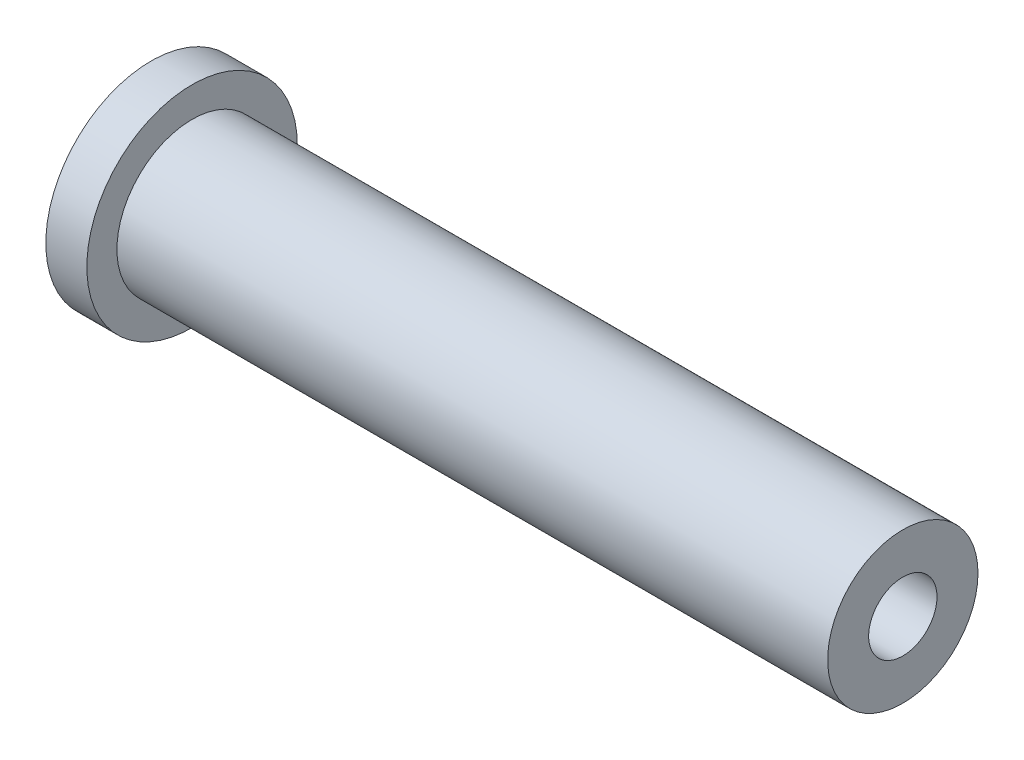
from build123d import *

# Parameters (mm, degrees)
BROCA_DE_ROSQUEAR_PARA_TARRAXA_DE_M61_D     = 5
BROCA_DE_ROSQUEAR_PARA_TARRAXA_DE_M61_DEPTH = 12
BROCA_DE_ROSQUEAR_PARA_TARRAXA_DE_M61_TIP   = 1.502151548


with BuildPart() as part:
    # Sketch1 → Revolve1 (revolve)
    with BuildSketch(Plane.XY, mode=Mode.PRIVATE) as revolve1_sk:
        Polygon((0, 0), (0, 7.7), (3, 7.7), (3, 5.5), (55, 5.5), (55, 0), align=None)
    revolve(revolve1_sk.sketch.rotate(Axis((0, 0, 0), (-1, 0, 0)), 90), axis=Axis((0, 0, 0), (-1, 0, 0)))

    # Broca de rosquear para tarraxa de M61
    with Locations(Plane(origin=(55, 0, 0), x_dir=(0, 0, -1), z_dir=(1, 0, 0))):
        with Locations((0, 0)):
            Hole(BROCA_DE_ROSQUEAR_PARA_TARRAXA_DE_M61_D / 2, depth=BROCA_DE_ROSQUEAR_PARA_TARRAXA_DE_M61_DEPTH)
            with Locations((0, 0, -(BROCA_DE_ROSQUEAR_PARA_TARRAXA_DE_M61_DEPTH + BROCA_DE_ROSQUEAR_PARA_TARRAXA_DE_M61_TIP / 2))):  # 118° drill point
                Cone(0, BROCA_DE_ROSQUEAR_PARA_TARRAXA_DE_M61_D / 2, BROCA_DE_ROSQUEAR_PARA_TARRAXA_DE_M61_TIP, mode=Mode.SUBTRACT)


solid = part.part
